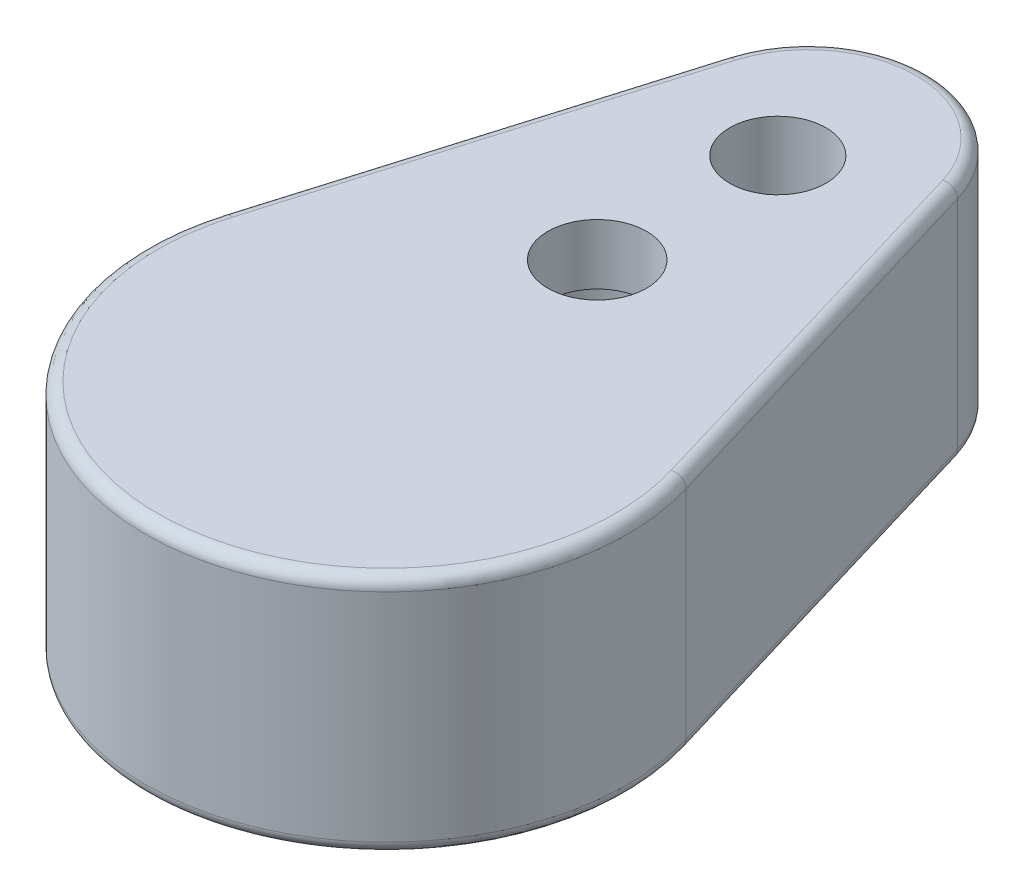
from build123d import *

# Parameters (mm, degrees)
BOSS_EXTRUDE1_DEPTH     = 20
FILLET1_R               = 1
SKETCH2_R               = 4
CUT_EXTRUDE1_DEPTH      = 15
SKETCH3_R               = 5
CUT_EXTRUDE2_DEPTH      = 15
CUT_EXTRUDE3_DEPTH      = 46.069390988
CUT_EXTRUDE3_DEPTH_BACK = 46.069390988
SKETCH4_R               = 4.1
SKETCH4_R_2             = 3.1


with BuildPart() as part:
    # Sketch1 → Boss-Extrude1 (new body)
    with BuildSketch(Plane(origin=(0, 0, 0), x_dir=(1, 0, 0), z_dir=(0, 1, 0))):
        with BuildLine():
            Line((-9.583148475, 20.357142857), (-19.16629695, -11.785714286))
            ThreePointArc((-19.16629695, -11.785714286), (0, -37.5), (19.16629695, -11.785714286))
            Line((19.16629695, -11.785714286), (9.583148475, 20.357142857))
            ThreePointArc((9.583148475, 20.357142857), (0, 27.5), (-9.583148475, 20.357142857))
        make_face()
    extrude(amount=BOSS_EXTRUDE1_DEPTH)

    # Fillet1
    fillet1_edges = [part.edges().sort_by_distance(p)[0] for p in [
        (0, 20, -27.5),
        (-14.374722712, 20, -4.285714286),
        (0, 20, 37.5),
        (-14.374722712, 0, -4.285714286),
        (0, 0, -27.5),
        (14.374722712, 0, -4.285714286),
        (0, 0, 37.5),
        (14.374722712, 20, -4.285714286),
    ]]
    fillet(fillet1_edges, radius=FILLET1_R)

    # Sketch2 → Cut-Extrude1 (cut)
    with BuildSketch(Plane(origin=(0, 20, 0), x_dir=(1, 0, 0), z_dir=(0, 1, 0))):
        with Locations(Location((0, 15, 0), (0, 0, 270))):
            Circle(SKETCH2_R)
    extrude(amount=-CUT_EXTRUDE1_DEPTH, mode=Mode.SUBTRACT)

    # Sketch3 → Cut-Extrude2 (cut)
    with BuildSketch(Plane.XZ):
        with Locations(Location((0, 0, 0), (0, 0, 270))):
            Circle(SKETCH3_R)
    extrude(amount=-CUT_EXTRUDE2_DEPTH, mode=Mode.SUBTRACT)

    # Sketch4 → Cut-Extrude3 (cut, two sides: drawn at the far end of the back side and taken through both)
    with BuildSketch(Plane.XZ.offset(-15).offset(-CUT_EXTRUDE3_DEPTH_BACK)):
        with Locations(Location((0, 0, 0), (0, 0, 270))):
            Circle(SKETCH4_R)
        with Locations(Location((0, -15, 0), (0, 0, 270))):
            Circle(SKETCH4_R_2)
    extrude(amount=CUT_EXTRUDE3_DEPTH + CUT_EXTRUDE3_DEPTH_BACK, mode=Mode.SUBTRACT)


solid = part.part
